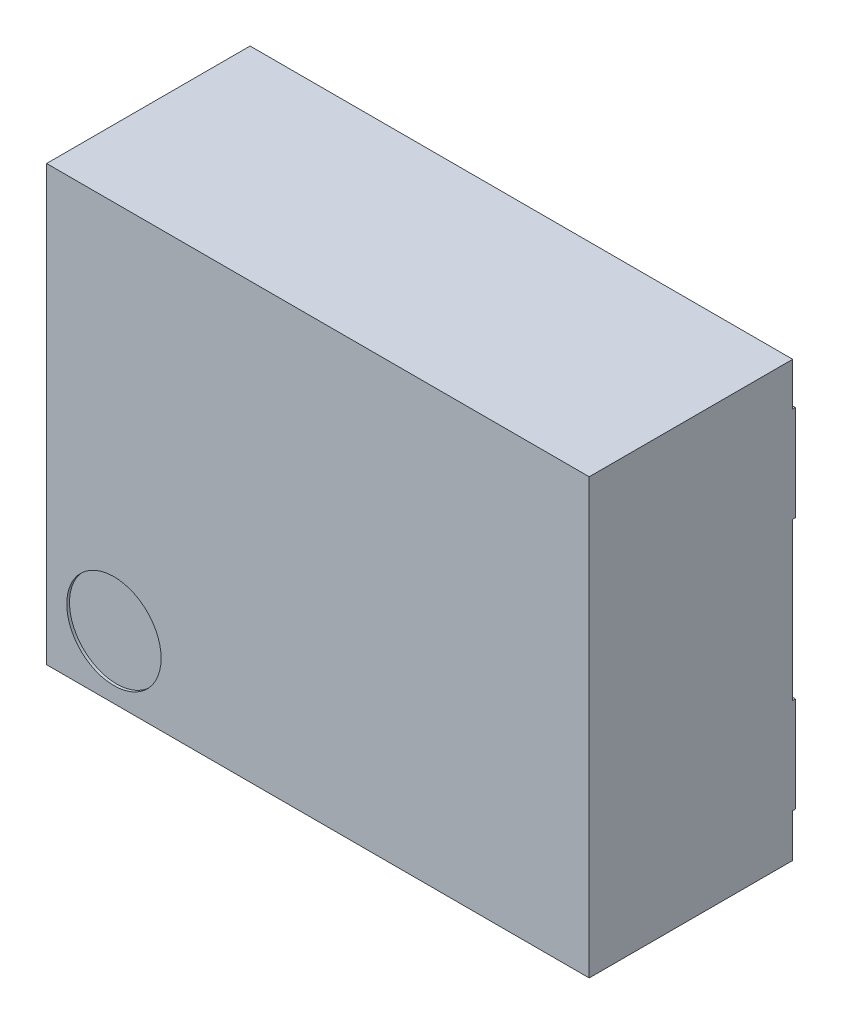
from build123d import *

# Parameters (mm, degrees)
SKETCH1_W           = 2
SKETCH1_H           = 1.6
BOSS_EXTRUDE1_DEPTH = 0.75
BOSS_EXTRUDE2_DEPTH = 0.01
CUT_EXTRUDE1_DEPTH  = 0.01
SKETCH4_R           = 0.17390424
CUT_EXTRUDE2_DEPTH  = 0.01


with BuildPart() as part:
    # Sketch1 → Boss-Extrude1 (new body)
    with BuildSketch(Plane.XY):
        Rectangle(SKETCH1_W, SKETCH1_H)
    extrude(amount=BOSS_EXTRUDE1_DEPTH)

    # Sketch2 → Boss-Extrude2 (add)
    with BuildSketch(Plane.XY):
        with BuildLine():
            ThreePointArc((0.849921965, -0.225), (0.885277304, -0.239644661), (0.899921965, -0.275))
            Line((0.899921965, -0.275), (0.899921965, -0.28901736))
            Line((0.899921965, -0.28901736), (1, -0.28901736))
            Line((1, -0.28901736), (1, -0.64098264))
            Line((1, -0.64098264), (0.899921965, -0.64098264))
            Line((0.899921965, -0.64098264), (0.899921965, -0.655))
            ThreePointArc((0.899921965, -0.655), (0.885277304, -0.690355339), (0.849921965, -0.705))
            Line((0.849921965, -0.705), (0.37, -0.705))
            ThreePointArc((0.37, -0.705), (0.334644661, -0.690355339), (0.32, -0.655))
            Line((0.32, -0.655), (0.32, -0.275))
            ThreePointArc((0.32, -0.275), (0.334644661, -0.239644661), (0.37, -0.225))
            Line((0.37, -0.225), (0.849921965, -0.225))
        make_face()
        with BuildLine():
            ThreePointArc((-0.849921965, 0.225), (-0.885277304, 0.239644661), (-0.899921965, 0.275))
            Line((-0.899921965, 0.275), (-0.899921965, 0.28901736))
            Line((-0.899921965, 0.28901736), (-1, 0.28901736))
            Line((-1, 0.28901736), (-1, 0.64098264))
            Line((-1, 0.64098264), (-0.899921965, 0.64098264))
            Line((-0.899921965, 0.64098264), (-0.899921965, 0.655))
            ThreePointArc((-0.899921965, 0.655), (-0.885277304, 0.690355339), (-0.849921965, 0.705))
            Line((-0.849921965, 0.705), (-0.37, 0.705))
            ThreePointArc((-0.37, 0.705), (-0.334644661, 0.690355339), (-0.32, 0.655))
            Line((-0.32, 0.655), (-0.32, 0.275))
            ThreePointArc((-0.32, 0.275), (-0.334644661, 0.239644661), (-0.37, 0.225))
            Line((-0.37, 0.225), (-0.849921965, 0.225))
        make_face()
        with BuildLine():
            Line((-0.849921965, -0.705), (-0.37, -0.705))
            ThreePointArc((-0.37, -0.705), (-0.334644661, -0.690355339), (-0.32, -0.655))
            Line((-0.32, -0.655), (-0.32, -0.275))
            ThreePointArc((-0.32, -0.275), (-0.334644661, -0.239644661), (-0.37, -0.225))
            Line((-0.37, -0.225), (-0.849921965, -0.225))
            ThreePointArc((-0.849921965, -0.225), (-0.885277304, -0.239644661), (-0.899921965, -0.275))
            Line((-0.899921965, -0.275), (-0.899921965, -0.28901736))
            Line((-0.899921965, -0.28901736), (-1, -0.28901736))
            Line((-1, -0.28901736), (-1, -0.64098264))
            Line((-1, -0.64098264), (-0.899921965, -0.64098264))
            Line((-0.899921965, -0.64098264), (-0.899921965, -0.655))
            ThreePointArc((-0.899921965, -0.655), (-0.885277304, -0.690355339), (-0.849921965, -0.705))
        make_face()
        with BuildLine():
            Line((0.849921965, 0.705), (0.37, 0.705))
            ThreePointArc((0.37, 0.705), (0.334644661, 0.690355339), (0.32, 0.655))
            Line((0.32, 0.655), (0.32, 0.275))
            ThreePointArc((0.32, 0.275), (0.334644661, 0.239644661), (0.37, 0.225))
            Line((0.37, 0.225), (0.849921965, 0.225))
            ThreePointArc((0.849921965, 0.225), (0.885277304, 0.239644661), (0.899921965, 0.275))
            Line((0.899921965, 0.275), (0.899921965, 0.28901736))
            Line((0.899921965, 0.28901736), (1, 0.28901736))
            Line((1, 0.28901736), (1, 0.64098264))
            Line((1, 0.64098264), (0.899921965, 0.64098264))
            Line((0.899921965, 0.64098264), (0.899921965, 0.655))
            ThreePointArc((0.899921965, 0.655), (0.885277304, 0.690355339), (0.849921965, 0.705))
        make_face()
    extrude(amount=-BOSS_EXTRUDE2_DEPTH)

    # Sketch3 → Cut-Extrude1 (cut)
    with BuildSketch(Plane(origin=(0, 0, -0.01), x_dir=(-1, 0, 0), z_dir=(0, 0, -1))):
        Polygon((0.259506614, -0.530356554), (0.673891884, -0.115971284), (0.259506614, -0.115971284), align=None)
    extrude(amount=-CUT_EXTRUDE1_DEPTH, mode=Mode.SUBTRACT)

    # Sketch4 → Cut-Extrude2 (cut)
    with BuildSketch(Plane.XY.offset(0.75)):
        with Locations((-0.751829449, -0.568683388)):
            Circle(SKETCH4_R)
    extrude(amount=-CUT_EXTRUDE2_DEPTH, mode=Mode.SUBTRACT)


solid = part.part
